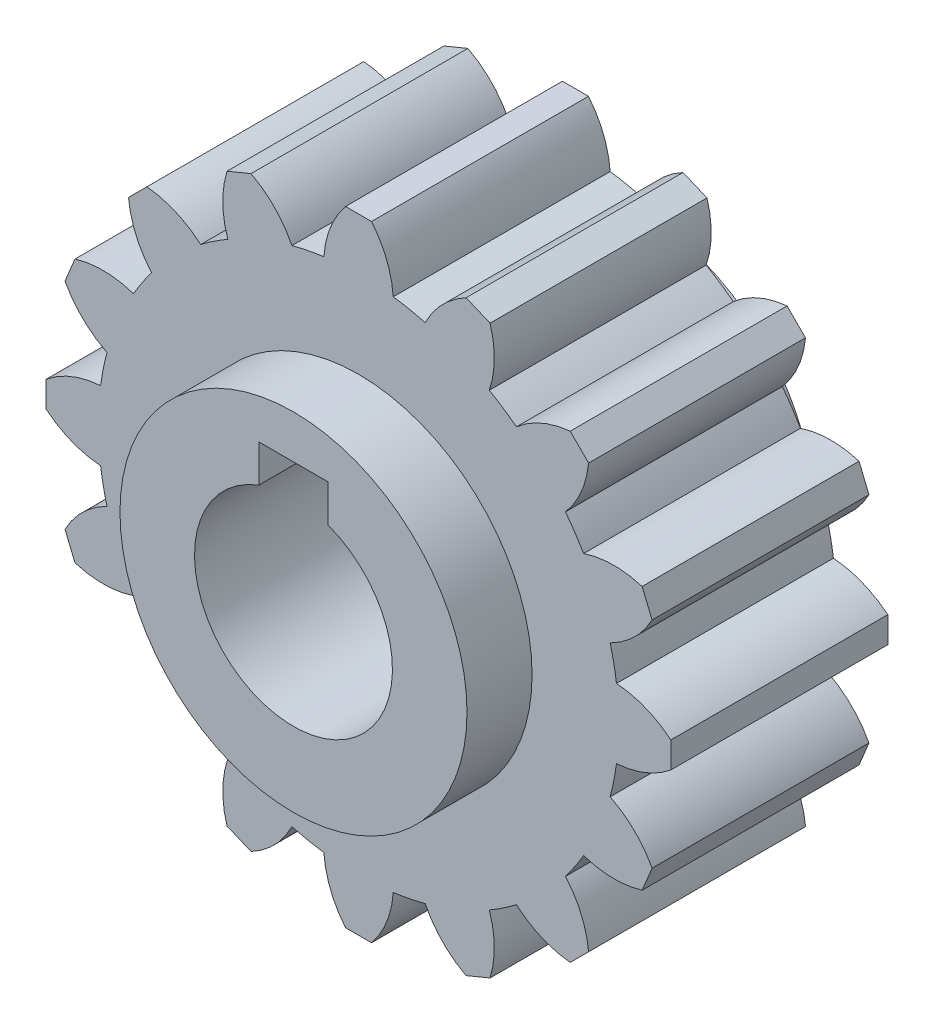
from build123d import *

# Parameters (mm, degrees)
BOSS_EXTRUDE1_DEPTH     = 12.5
SKETCH3_R               = 20
BOSS_EXTRUDE2_DEPTH     = 20
CUT_EXTRUDE1_DEPTH      = 65.745656225
CUT_EXTRUDE1_DEPTH_BACK = 65.745656225


with BuildPart() as part:
    # Sketch2 → Boss-Extrude1 (new, symmetric)
    with BuildSketch(Plane.XY):
        with BuildLine():
            Line((1.5, 36), (-1.5, 36))
            ThreePointArc((-1.5, 36), (-3.242504384, 33.062509074), (-4, 29.732137495))
            ThreePointArc((-4, 29.732137495), (-5.85270966, 29.423558412), (-7.682478298, 28.999647019))
            ThreePointArc((-7.682478298, 28.999647019), (-9.656791021, 31.786628134), (-12.390784266, 33.833688319))
            Line((-12.390784266, 33.833688319), (-15.162422864, 32.685638022))
            ThreePointArc((-15.162422864, 32.685638022), (-15.64815789, 29.30492272), (-15.073514558, 25.93817956))
            ThreePointArc((-15.073514558, 25.93817956), (-16.667106991, 24.944088369), (-18.195368917, 23.852223166))
            ThreePointArc((-18.195368917, 23.852223166), (-21.085927531, 25.671521208), (-24.395183951, 26.516504294))
            Line((-24.395183951, 26.516504294), (-26.516504294, 24.395183951))
            ThreePointArc((-26.516504294, 24.395183951), (-25.671521208, 21.085927531), (-23.852223166, 18.195368917))
            ThreePointArc((-23.852223166, 18.195368917), (-24.944088369, 16.667106991), (-25.93817956, 15.073514558))
            ThreePointArc((-25.93817956, 15.073514558), (-29.30492272, 15.64815789), (-32.685638022, 15.162422864))
            Line((-32.685638022, 15.162422864), (-33.833688319, 12.390784266))
            ThreePointArc((-33.833688319, 12.390784266), (-31.786628134, 9.656791021), (-28.999647019, 7.682478298))
            ThreePointArc((-28.999647019, 7.682478298), (-29.423558412, 5.85270966), (-29.732137495, 4))
            ThreePointArc((-29.732137495, 4), (-33.062509074, 3.242504384), (-36, 1.5))
            Line((-36, 1.5), (-36, -1.5))
            ThreePointArc((-36, -1.5), (-33.062509074, -3.242504384), (-29.732137495, -4))
            ThreePointArc((-29.732137495, -4), (-29.423558412, -5.85270966), (-28.999647019, -7.682478298))
            ThreePointArc((-28.999647019, -7.682478298), (-31.786628134, -9.656791021), (-33.833688319, -12.390784266))
            Line((-33.833688319, -12.390784266), (-32.685638022, -15.162422864))
            ThreePointArc((-32.685638022, -15.162422864), (-29.30492272, -15.64815789), (-25.93817956, -15.073514558))
            ThreePointArc((-25.93817956, -15.073514558), (-21.213203436, -21.213203436), (-15.073514558, -25.93817956))
            ThreePointArc((-15.073514558, -25.93817956), (-15.64815789, -29.30492272), (-15.162422864, -32.685638022))
            Line((-15.162422864, -32.685638022), (-12.390784266, -33.833688319))
            ThreePointArc((-12.390784266, -33.833688319), (-9.656791021, -31.786628134), (-7.682478298, -28.999647019))
            ThreePointArc((-7.682478298, -28.999647019), (-5.85270966, -29.423558412), (-4, -29.732137495))
            ThreePointArc((-4, -29.732137495), (-3.242504384, -33.062509074), (-1.5, -36))
            Line((-1.5, -36), (1.5, -36))
            ThreePointArc((1.5, -36), (3.242504384, -33.062509074), (4, -29.732137495))
            ThreePointArc((4, -29.732137495), (5.85270966, -29.423558412), (7.682478298, -28.999647019))
            ThreePointArc((7.682478298, -28.999647019), (9.656791021, -31.786628134), (12.390784266, -33.833688319))
            Line((12.390784266, -33.833688319), (15.162422864, -32.685638022))
            ThreePointArc((15.162422864, -32.685638022), (15.64815789, -29.30492272), (15.073514558, -25.93817956))
            ThreePointArc((15.073514558, -25.93817956), (16.667106991, -24.944088369), (18.195368917, -23.852223166))
            ThreePointArc((18.195368917, -23.852223166), (21.085927531, -25.671521208), (24.395183951, -26.516504294))
            Line((24.395183951, -26.516504294), (26.516504294, -24.395183951))
            ThreePointArc((26.516504294, -24.395183951), (25.671521208, -21.085927531), (23.852223166, -18.195368917))
            ThreePointArc((23.852223166, -18.195368917), (24.944088369, -16.667106991), (25.93817956, -15.073514558))
            ThreePointArc((25.93817956, -15.073514558), (29.30492272, -15.64815789), (32.685638022, -15.162422864))
            Line((32.685638022, -15.162422864), (33.833688319, -12.390784266))
            ThreePointArc((33.833688319, -12.390784266), (31.786628134, -9.656791021), (28.999647019, -7.682478298))
            ThreePointArc((28.999647019, -7.682478298), (29.423558412, -5.85270966), (29.732137495, -4))
            ThreePointArc((29.732137495, -4), (33.062509074, -3.242504384), (36, -1.5))
            Line((36, -1.5), (36, 1.5))
            ThreePointArc((36, 1.5), (33.062509074, 3.242504384), (29.732137495, 4))
            ThreePointArc((29.732137495, 4), (29.423558412, 5.85270966), (28.999647019, 7.682478298))
            ThreePointArc((28.999647019, 7.682478298), (31.786628134, 9.656791021), (33.833688319, 12.390784266))
            Line((33.833688319, 12.390784266), (32.685638022, 15.162422864))
            ThreePointArc((32.685638022, 15.162422864), (29.30492272, 15.64815789), (25.93817956, 15.073514558))
            ThreePointArc((25.93817956, 15.073514558), (24.944088369, 16.667106991), (23.852223166, 18.195368917))
            ThreePointArc((23.852223166, 18.195368917), (25.671521208, 21.085927531), (26.516504294, 24.395183951))
            Line((26.516504294, 24.395183951), (24.395183951, 26.516504294))
            ThreePointArc((24.395183951, 26.516504294), (21.085927531, 25.671521208), (18.195368917, 23.852223166))
            ThreePointArc((18.195368917, 23.852223166), (16.667106991, 24.944088369), (15.073514558, 25.93817956))
            ThreePointArc((15.073514558, 25.93817956), (15.64815789, 29.30492272), (15.162422864, 32.685638022))
            Line((15.162422864, 32.685638022), (12.390784266, 33.833688319))
            ThreePointArc((12.390784266, 33.833688319), (9.656791021, 31.786628134), (7.682478298, 28.999647019))
            ThreePointArc((7.682478298, 28.999647019), (5.85270966, 29.423558412), (4, 29.732137495))
            ThreePointArc((4, 29.732137495), (3.242504384, 33.062509074), (1.5, 36))
        make_face()
    extrude(amount=BOSS_EXTRUDE1_DEPTH, both=True)

    # Sketch3 → Boss-Extrude2 (add, symmetric)
    with BuildSketch(Plane.XY):
        Circle(SKETCH3_R)
    extrude(amount=BOSS_EXTRUDE2_DEPTH, both=True)

    # Sketch4 → Cut-Extrude1 (cut, two sides: drawn at the far end of the back side and taken through both)
    with BuildSketch(Plane.XY.offset(20).offset(-CUT_EXTRUDE1_DEPTH_BACK)):
        with BuildLine():
            Line((4, 15), (4, 10.683441748))
            ThreePointArc((4, 10.683441748), (0, -11.407713513), (-4, 10.683441748))
            Line((-4, 10.683441748), (-4, 15))
            Line((-4, 15), (4, 15))
        make_face()
    extrude(amount=CUT_EXTRUDE1_DEPTH + CUT_EXTRUDE1_DEPTH_BACK, mode=Mode.SUBTRACT)


solid = part.part
